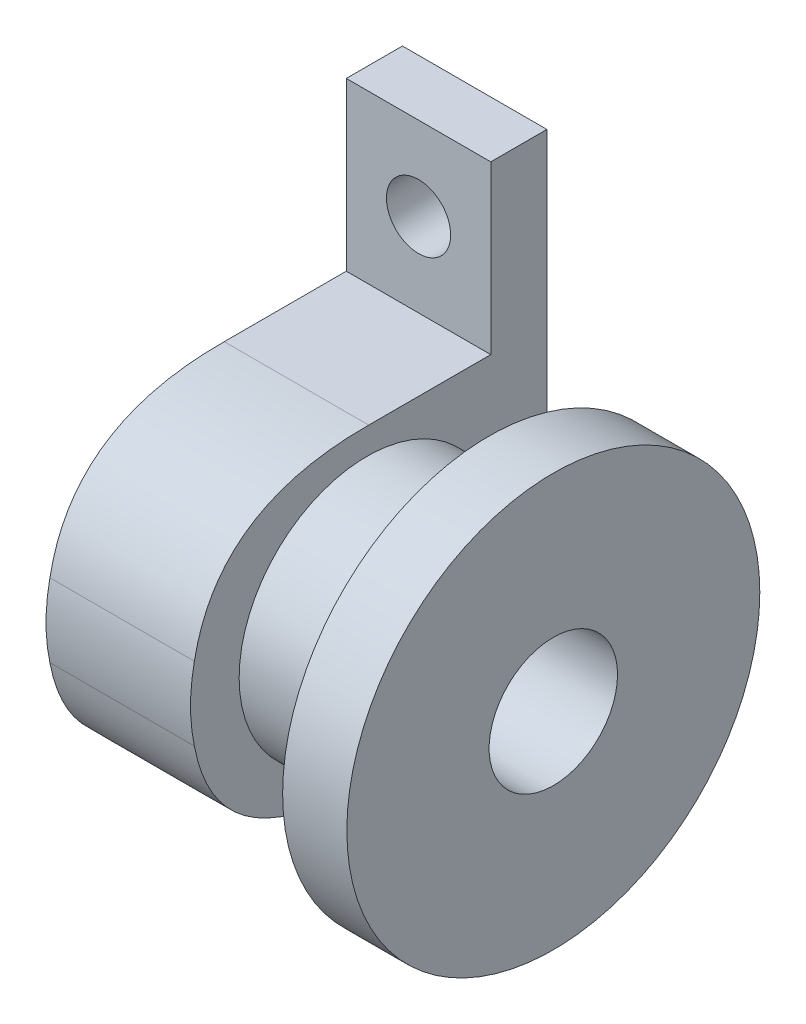
from build123d import *
from build123d.topology import SkipClean

# Parameters (mm, degrees)
SKETCH1_W           = 100
SKETCH1_H           = 22.5
BOSS_EXTRUDE1_DEPTH = 55.5
CUT_EXTRUDE1_DEPTH  = 79.016023995
CUT_EXTRUDE2_DEPTH  = 73.059409747
CUT_EXTRUDE3_DEPTH  = 73.059409747
SKETCH6_R           = 12
SKETCH6_R_2         = 10
BOSS_EXTRUDE2_DEPTH = 5
BOSS_EXTRUDE3_START = 19
SKETCH7_R           = 19.927383843
SKETCH7_R_2         = 10
BOSS_EXTRUDE3_DEPTH = 19
BOSS_EXTRUDE5_START = 10
SKETCH9_R           = 32.155692567
SKETCH9_R_2         = 10
BOSS_EXTRUDE5_DEPTH = 10


with BuildPart() as part:
    # Sketch1 → Boss-Extrude1 (new body)
    with BuildSketch(Plane(origin=(0, 0, 0), x_dir=(0, 1, 0), z_dir=(0, 0, 1))):
        with Locations((0, -11.25)):
            Rectangle(SKETCH1_W, SKETCH1_H)
    extrude(amount=BOSS_EXTRUDE1_DEPTH)

    # Sketch2 → Cut-Extrude1 (cut, through all)
    with BuildSketch(Plane.YZ.offset(22.5)):
        with BuildLine():
            Line((-50, 8.742021972), (-24, 8.742021972))
            Line((-24, 8.742021972), (-24, 14.574278418))
            ThreePointArc((-24, 14.574278418), (-27.5, 28), (-24, 41.425721582))
            Line((-24, 41.425721582), (-24, 55.5))
            Line((-24, 55.5), (-50, 55.5))
            Line((-50, 55.5), (-50, 8.742021972))
        make_face()
        with BuildLine():
            ThreePointArc((-24, 41.425721582), (-27.5, 28), (-24, 14.574278418))
            Line((-24, 14.574278418), (-24, 27.75))
            add(Edge.make_bspline(
                [(-24, 28.630883492), (-24.003292455, 28.193991063), (-24, 27.75)],
                knots=[0.983572463, 0.983572463, 0.983572463, 1, 1, 1], degree=2))
            Line((-24, 28.630883492), (-24, 41.425721582))
        make_face()
        with BuildLine():
            ThreePointArc((-15.102725788, 50.981681265), (-20.126720607, 46.73940014), (-24, 41.425721582))
            Line((-24, 41.425721582), (-24, 28.630883492))
            add(Edge.make_bspline(
                [(-15.102725788, 50.981681265), (-23.880610505, 44.473278164), (-24, 28.630883492)],
                knots=[0.387884574, 0.387884574, 0.387884574, 0.983572463, 0.983572463, 0.983572463], degree=2))
        make_face()
        with BuildLine():
            Line((-24, 55.5), (-24, 41.425721582))
            ThreePointArc((-24, 41.425721582), (-20.126720607, 46.73940014), (-15.102725788, 50.981681265))
            add(Edge.make_bspline(
                [(-5.719329936, 54.898685192), (-11.246534385, 53.840872164), (-15.102725788, 50.981681265)],
                knots=[0.126194361, 0.126194361, 0.126194361, 0.387884574, 0.387884574, 0.387884574], degree=2))
            ThreePointArc((-5.719329936, 54.898685192), (-2.875426682, 55.349258151), (0, 55.5))
            Line((0, 55.5), (-24, 55.5))
        make_face()
        with BuildLine():
            ThreePointArc((0, 38), (-10, 28), (0, 18))
            Line((0, 18), (0, 38))
        make_face()
        with BuildLine():
            Line((0, 38), (0, 18))
            ThreePointArc((0, 18), (7.071067812, 20.928932188), (10, 28))
            ThreePointArc((10, 28), (7.071067812, 35.071067812), (0, 38))
        make_face()
        with BuildLine():
            Line((24, 55.5), (0, 55.5))
            ThreePointArc((0, 55.5), (2.875426682, 55.349258151), (5.719329936, 54.898685192))
            add(Edge.make_bspline(
                [(5.719329936, 54.898685192), (11.246534385, 53.840872164), (15.102725788, 50.981681265)],
                knots=[0.126194361, 0.126194361, 0.126194361, 0.387884574, 0.387884574, 0.387884574], degree=2))
            ThreePointArc((15.102725788, 50.981681265), (20.126720607, 46.73940014), (24, 41.425721582))
            Line((24, 41.425721582), (24, 55.5))
        make_face()
        with BuildLine():
            Line((24, 14.574278418), (24, 8.742021972))
            Line((24, 8.742021972), (50, 8.742021972))
            Line((50, 8.742021972), (50, 14.574278418))
            Line((50, 14.574278418), (50, 55.5))
            Line((50, 55.5), (24, 55.5))
            Line((24, 55.5), (24, 41.425721582))
            ThreePointArc((24, 41.425721582), (26.610618181, 34.937218463), (27.5, 28))
            ThreePointArc((27.5, 28), (26.610618181, 21.062781537), (24, 14.574278418))
        make_face()
        with BuildLine():
            Line((24, 27.75), (24, 14.574278418))
            ThreePointArc((24, 14.574278418), (26.610618181, 21.062781537), (27.5, 28))
            ThreePointArc((27.5, 28), (26.610618181, 34.937218463), (24, 41.425721582))
            Line((24, 41.425721582), (24, 28.630883492))
            add(Edge.make_bspline(
                [(24, 28.630883492), (24.003292455, 28.193991063), (24, 27.75)],
                knots=[0.983572463, 0.983572463, 0.983572463, 1, 1, 1], degree=2))
        make_face()
        with BuildLine():
            ThreePointArc((24, 41.425721582), (20.126720607, 46.73940014), (15.102725788, 50.981681265))
            add(Edge.make_bspline(
                [(15.102725788, 50.981681265), (23.880610505, 44.473278164), (24, 28.630883492)],
                knots=[0.387884574, 0.387884574, 0.387884574, 0.983572463, 0.983572463, 0.983572463], degree=2))
            Line((24, 28.630883492), (24, 41.425721582))
        make_face()
    extrude(amount=-CUT_EXTRUDE1_DEPTH, mode=Mode.SUBTRACT)

    # Sketch3 → Cut-Extrude2 (cut, through all)
    with BuildSketch(Plane.XY.offset(8.742021972)):
        with BuildLine():
            ThreePointArc((16.25, 37), (15.797494838, 39.078530898), (14.521883722, 40.780843412))
            Line((14.521883722, 40.780843412), (7.978116278, 33.219156588))
            ThreePointArc((7.978116278, 33.219156588), (13.328530898, 32.452505162), (16.25, 37))
        make_face()
        with BuildLine():
            Line((7.978116278, 33.219156588), (14.521883722, 40.780843412))
            ThreePointArc((14.521883722, 40.780843412), (7.469156588, 40.271883722), (7.978116278, 33.219156588))
        make_face()
    extrude(amount=-CUT_EXTRUDE2_DEPTH, mode=Mode.SUBTRACT)

    # Sketch5 → Cut-Extrude3 (cut, through all)
    with BuildSketch(Plane.XY.offset(8.742021972)):
        with BuildLine():
            ThreePointArc((16.248437988, -37), (13.32788156, -32.45392581), (7.979138422, -33.220337732))
            Line((7.979138422, -33.220337732), (14.520861578, -40.779662268))
            ThreePointArc((14.520861578, -40.779662268), (15.79607419, -39.07788156), (16.248437988, -37))
        make_face()
        with BuildLine():
            Line((14.520861578, -40.779662268), (7.979138422, -33.220337732))
            ThreePointArc((7.979138422, -33.220337732), (7.470337732, -40.270861578), (14.520861578, -40.779662268))
        make_face()
    extrude(amount=-CUT_EXTRUDE3_DEPTH, mode=Mode.SUBTRACT)

    # Sketch6 → Boss-Extrude2 (add)
    with SkipClean():  # the faces are left unmerged after this step: merging them gives an invalid solid
        with BuildSketch(Plane(origin=(0, 0, 0), x_dir=(0, -1, 0), z_dir=(-1, 0, 0))):
            with Locations(Location((0, 28, 0), (0, 0, 270))):
                Circle(SKETCH6_R)
            with Locations(Location((0, 28, 0), (0, 0, 270))):
                Circle(SKETCH6_R_2, mode=Mode.SUBTRACT)
        extrude(amount=BOSS_EXTRUDE2_DEPTH)

    # Sketch7 → Boss-Extrude3 (add)
    with SkipClean():  # the faces are left unmerged after this step: merging them gives an invalid solid
        with BuildSketch(Plane.YZ.offset(22.5).offset(BOSS_EXTRUDE3_START)):
            with Locations(Location((0, 28, 0), (0, 0, 270))):
                Circle(SKETCH7_R)
            with Locations(Location((0, 28, 0), (0, 0, 270))):
                Circle(SKETCH7_R_2, mode=Mode.SUBTRACT)
        extrude(amount=-BOSS_EXTRUDE3_DEPTH)

    # Sketch9 → Boss-Extrude5 (add)
    with SkipClean():  # the faces are left unmerged after this step: merging them gives an invalid solid
        with BuildSketch(Plane.YZ.offset(41.5).offset(BOSS_EXTRUDE5_START)):
            with Locations(Location((0, 28, 0), (0, 0, 270))):
                Circle(SKETCH9_R)
            with Locations(Location((0, 28, 0), (0, 0, 270))):
                Circle(SKETCH9_R_2, mode=Mode.SUBTRACT)
        extrude(amount=-BOSS_EXTRUDE5_DEPTH)


solid = part.part
